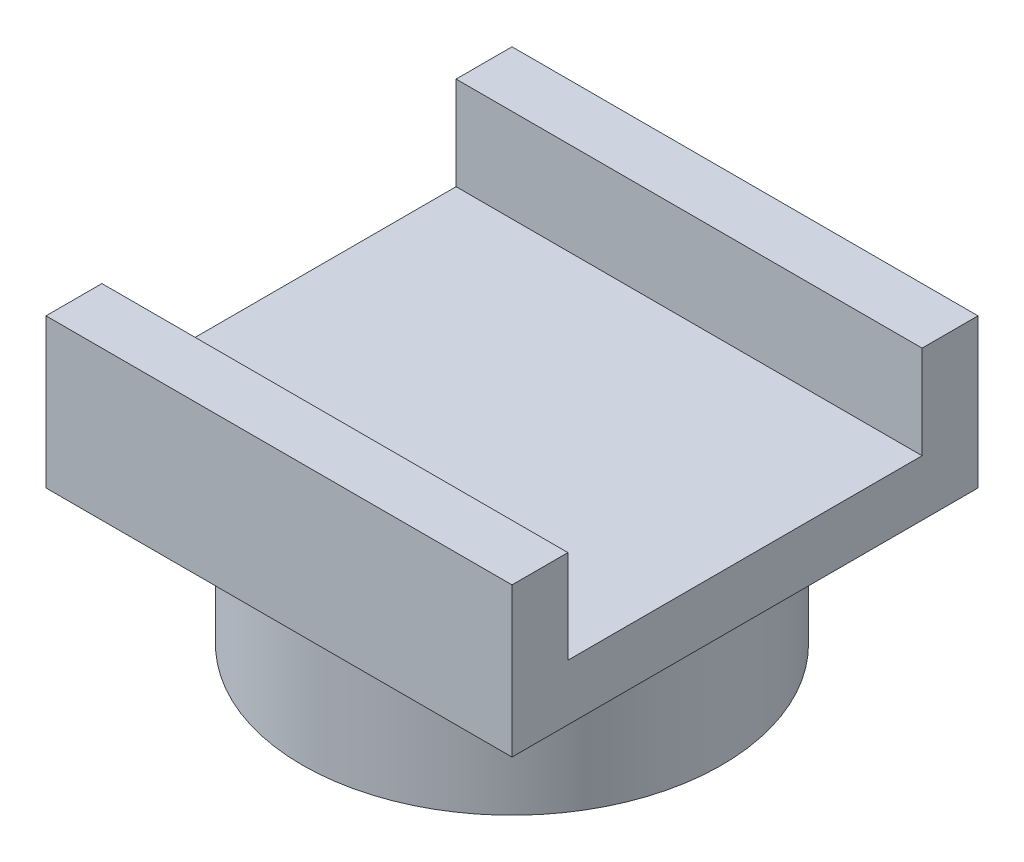
from build123d import *

# Parameters (mm, degrees)
ESQUISSE1_R        = 4.5
BOSS_EXTRU_1_DEPTH = 2.9
ESQUISSE2_W        = 10
ESQUISSE2_H        = 10
BOSS_EXTRU_2_DEPTH = 1.2
ESQUISSE3_W        = 10
ESQUISSE3_H        = 1.2
BOSS_EXTRU_3_DEPTH = 2


with BuildPart() as part:
    # Esquisse1 → Boss.-Extru.1 (new body)
    with BuildSketch(Plane(origin=(0, 0, 0), x_dir=(1, 0, 0), z_dir=(0, 1, 0))):
        with Locations(Location((0, 0, 0), (0, 0, 270))):
            Circle(ESQUISSE1_R)
    extrude(amount=BOSS_EXTRU_1_DEPTH)

    # Esquisse2 → Boss.-Extru.2 (add)
    with BuildSketch(Plane(origin=(0, 2.9, 0), x_dir=(1, 0, 0), z_dir=(0, 1, 0))):
        Rectangle(ESQUISSE2_W, ESQUISSE2_H)
    extrude(amount=BOSS_EXTRU_2_DEPTH)

    # Esquisse3 → Boss.-Extru.3 (add)
    with BuildSketch(Plane(origin=(0, 4.1, 0), x_dir=(1, 0, 0), z_dir=(0, 1, 0))):
        with Locations((0, 4.4)):
            Rectangle(ESQUISSE3_W, ESQUISSE3_H)
        with Locations((0, -4.4)):
            Rectangle(ESQUISSE3_W, ESQUISSE3_H)
    extrude(amount=BOSS_EXTRU_3_DEPTH)


solid = part.part
